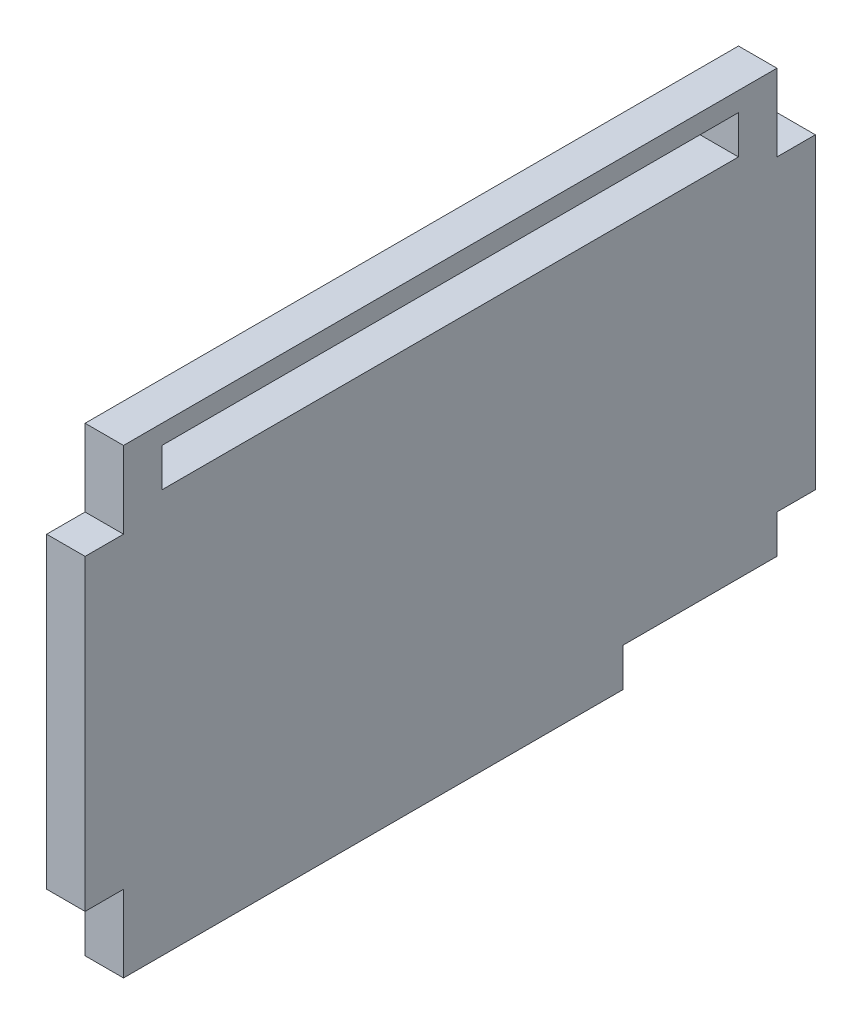
from build123d import *

# Parameters (mm, degrees)
SKETCH1_W           = 6.35
SKETCH1_H           = 76.2
BOSS_EXTRUDE1_DEPTH = 114.3
SKETCH2_W           = 6.35
SKETCH2_H           = 50.8
BOSS_EXTRUDE2_DEPTH = 6.35
SKETCH3_W           = 6.35
SKETCH3_H           = 12.7
SKETCH3_W_2         = 95.25
SKETCH3_H_2         = 6.35
SKETCH3_W_3         = 25.4
CUT_EXTRUDE1_DEPTH  = 121.65


with BuildPart() as part:
    # Sketch1 → Boss-Extrude1 (new body)
    with BuildSketch(Plane.XY):
        with Locations((-41.275, 0)):
            Rectangle(SKETCH1_W, SKETCH1_H)
    extrude(amount=BOSS_EXTRUDE1_DEPTH)

    # Sketch2 → Boss-Extrude2 (add, through all)
    with BuildSketch(Plane(origin=(-38.1, 0, 0), x_dir=(0, 0, -1), z_dir=(1, 0, 0))):
        with Locations((3.175, 0)):
            Rectangle(SKETCH2_W, SKETCH2_H)
    extrude(amount=-BOSS_EXTRUDE2_DEPTH)

    # Sketch3 → Cut-Extrude1 (cut, through all)
    with BuildSketch(Plane(origin=(-38.1, 0, 0), x_dir=(0, 0, -1), z_dir=(1, 0, 0))):
        with Locations((-111.125, -31.75)):
            Rectangle(SKETCH3_W, SKETCH3_H)
        with Locations((-111.125, 31.75)):
            Rectangle(SKETCH3_W, SKETCH3_H)
        with Locations((-53.975, 31.75)):
            Rectangle(SKETCH3_W_2, SKETCH3_H_2)
        with Locations((-12.7, -34.925)):
            Rectangle(SKETCH3_W_3, SKETCH3_H_2)
    extrude(amount=-CUT_EXTRUDE1_DEPTH, mode=Mode.SUBTRACT)


solid = part.part
